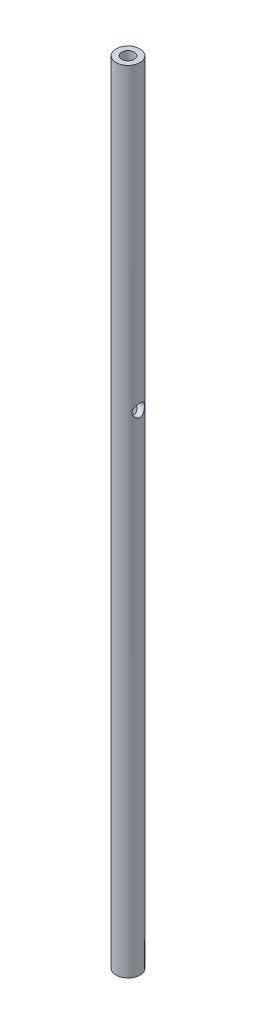
from build123d import *

# Parameters (mm, degrees)
SKETCH_2_R               = 9.5
SKETCH_2_R_2             = 5
CUT_EXTRUDE_1_DEPTH      = 631.143237685
CUT_EXTRUDE_1_DEPTH_BACK = 631.143237685
SKETCH_3_R               = 5


with BuildPart() as part:
    # По траектории1: sweep along a path in Эскиз1
    with BuildLine(Plane.XY) as sweep_1_path:
        Line((0, 0), (0, -630))
    # Эскиз2 → По траектории1 (sweep)
    with BuildSketch(Plane(origin=(0, 0, 0), x_dir=(1, 0, 0), z_dir=(0, 1, 0))):
        Circle(SKETCH_2_R)
        Circle(SKETCH_2_R_2, mode=Mode.SUBTRACT)
    sweep(path=sweep_1_path.line)

    # Эскиз3 → Вырез-Вытянуть1 (cut, two sides: drawn at the far end of the back side and taken through both)
    with BuildSketch(Plane(origin=(0, 0, 0), x_dir=(0, 0, -1), z_dir=(1, 0, 0)).offset(-CUT_EXTRUDE_1_DEPTH_BACK)):
        with Locations((0, -240)):
            Circle(SKETCH_3_R)
    extrude(amount=CUT_EXTRUDE_1_DEPTH + CUT_EXTRUDE_1_DEPTH_BACK, mode=Mode.SUBTRACT)


solid = part.part
